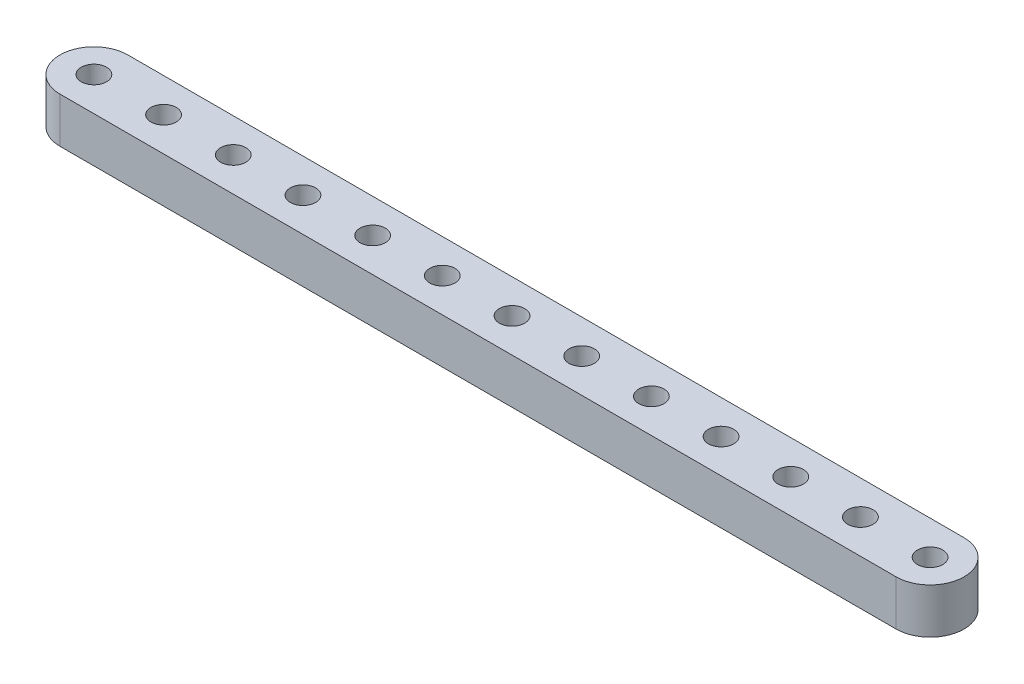
from build123d import *

# Parameters (mm, degrees)
SKETCH1_R           = 1.778
BOSS_EXTRUDE1_DEPTH = 6.35


with BuildPart() as part:
    # Sketch1 → Boss-Extrude1 (new body)
    with BuildSketch(Plane.XZ):
        with BuildLine():
            Line((-58.674, -4.7625), (58.674, -4.7625))
            ThreePointArc((58.674, -4.7625), (63.4365, 0), (58.674, 4.7625))
            Line((58.674, 4.7625), (-58.674, 4.7625))
            ThreePointArc((-58.674, 4.7625), (-63.4365, 0), (-58.674, -4.7625))
        make_face()
        with Locations(Location((58.674, 0, 0), (0, 0, 90))):
            Circle(SKETCH1_R, mode=Mode.SUBTRACT)
        with Locations(Location((48.895, 0, 0), (0, 0, 90))):
            Circle(SKETCH1_R, mode=Mode.SUBTRACT)
        with Locations(Location((39.116, 0, 0), (0, 0, 90))):
            Circle(SKETCH1_R, mode=Mode.SUBTRACT)
        with Locations(Location((29.337, 0, 0), (0, 0, 90))):
            Circle(SKETCH1_R, mode=Mode.SUBTRACT)
        with Locations(Location((19.558, 0, 0), (0, 0, 90))):
            Circle(SKETCH1_R, mode=Mode.SUBTRACT)
        with Locations(Location((9.779, 0, 0), (0, 0, 90))):
            Circle(SKETCH1_R, mode=Mode.SUBTRACT)
        with Locations(Location((0, 0, 0), (0, 0, 90))):
            Circle(SKETCH1_R, mode=Mode.SUBTRACT)
        with Locations(Location((-9.779, 0, 0), (0, 0, 90))):
            Circle(SKETCH1_R, mode=Mode.SUBTRACT)
        with Locations(Location((-19.558, 0, 0), (0, 0, 90))):
            Circle(SKETCH1_R, mode=Mode.SUBTRACT)
        with Locations(Location((-29.337, 0, 0), (0, 0, 90))):
            Circle(SKETCH1_R, mode=Mode.SUBTRACT)
        with Locations(Location((-39.116, 0, 0), (0, 0, 90))):
            Circle(SKETCH1_R, mode=Mode.SUBTRACT)
        with Locations(Location((-48.895, 0, 0), (0, 0, 90))):
            Circle(SKETCH1_R, mode=Mode.SUBTRACT)
        with Locations(Location((-58.674, 0, 0), (0, 0, 90))):
            Circle(SKETCH1_R, mode=Mode.SUBTRACT)
    extrude(amount=-BOSS_EXTRUDE1_DEPTH)


solid = part.part
